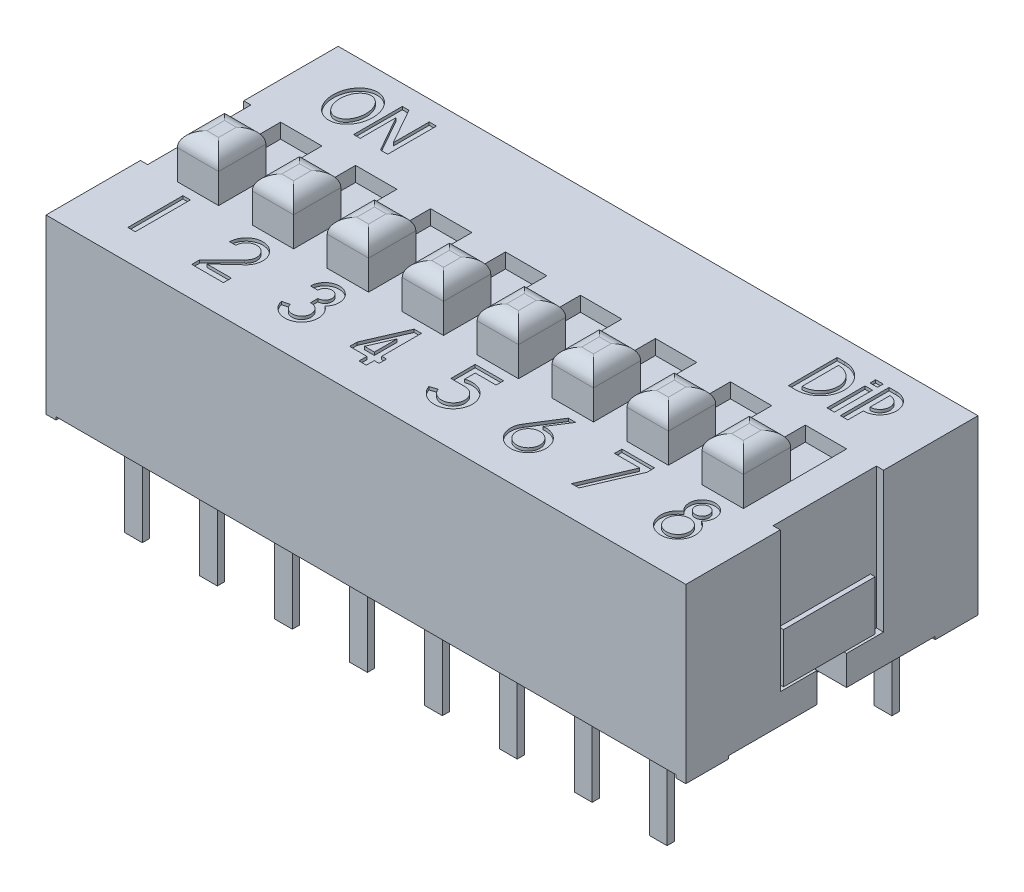
from build123d import *

# Parameters (mm, degrees)
SKETCH3_W                = 21.68
SKETCH3_H                = 9.9
BOSS_EXTRUDE2_DEPTH      = 5.85
SKETCH4_W                = 21
SKETCH4_H                = 0.2
CUT_EXTRUDE2_DEPTH       = 10
SKETCH5_W                = 7
SKETCH5_H                = 0.2
CUT_EXTRUDE3_DEPTH       = 22
SKETCH6_W                = 0.487470922
SKETCH6_H                = 3.5
CUT_EXTRUDE4_DEPTH       = 4.75
SKETCH7_W                = 0.995754675
SKETCH7_H                = 1
CUT_EXTRUDE5_DEPTH       = 22
BOSS_EXTRUDE3_DEPTH      = 0.15
BOSS_EXTRUDE3_DEPTH_BACK = 21.35
SKETCH8_W                = 3.1
SKETCH8_H                = 1.680627006
SKETCH9_W                = 1.4
SKETCH9_H                = 3.5
SKETCH9_W_2              = 1.401236364
CUT_EXTRUDE6_DEPTH       = 0.5
SKETCH12_W               = 1.4
SKETCH12_H               = 1.6
SKETCH12_W_2             = 1.401236364
BOSS_EXTRUDE4_DEPTH      = 2
FILLET1_R                = 0.5
SKETCH13_W               = 0.6
SKETCH13_H               = 0.25
SKETCH13_H_2             = 0.245714359
SKETCH13_H_3             = 0.242430455
SKETCH13_H_4             = 0.234982099
BOSS_EXTRUDE5_DEPTH      = 3.25
SKETCH14_RX              = 0.825749897
SKETCH14_RY              = 0.672122009
SKETCH14_RX_2            = 0.614511551
SKETCH14_RY_2            = 0.441680177
CUT_EXTRUDE7_DEPTH       = 0.1
CUT_EXTRUDE8_DEPTH       = 0.1
SKETCH16_W               = 0.253303666
SKETCH16_H               = 1.29006837
SKETCH16_H_2             = 0.191684563
CUT_EXTRUDE11_DEPTH      = 0.1
SKETCH17_R               = 0.396651096
SKETCH17_R_2             = 0.236606637
SKETCH17_R_3             = 0.394040753
SKETCH17_W               = 0.251849048
SKETCH17_H               = 1.867622834
CUT_EXTRUDE12_DEPTH      = 0.1


with BuildPart() as part:
    # Sketch3 → Boss-Extrude2 (new body)
    with BuildSketch(Plane(origin=(0, 0, 0), x_dir=(1, 0, 0), z_dir=(0, 1, 0))):
        Rectangle(SKETCH3_W, SKETCH3_H)
    extrude(amount=-BOSS_EXTRUDE2_DEPTH)

    # Sketch4 → Cut-Extrude2 (cut)
    with BuildSketch(Plane.XY.offset(4.95)):
        with Locations((0, -5.85)):
            Rectangle(SKETCH4_W, SKETCH4_H)
    extrude(amount=-CUT_EXTRUDE2_DEPTH, mode=Mode.SUBTRACT)

    # Sketch5 → Cut-Extrude3 (cut)
    with BuildSketch(Plane.ZY.offset(10.84)):
        with Locations((0, -5.85)):
            Rectangle(SKETCH5_W, SKETCH5_H)
    extrude(amount=-CUT_EXTRUDE3_DEPTH, mode=Mode.SUBTRACT)

    # Sketch6 → Cut-Extrude4 (cut)
    with BuildSketch(Plane(origin=(0, 0, 0), x_dir=(1, 0, 0), z_dir=(0, 1, 0))):
        with Locations((-10.84, 0)):
            Rectangle(SKETCH6_W, SKETCH6_H)
        with Locations((10.84, 0)):
            Rectangle(SKETCH6_W, SKETCH6_H)
    extrude(amount=-CUT_EXTRUDE4_DEPTH, mode=Mode.SUBTRACT)

    # Sketch7 → Cut-Extrude5 (cut)
    with BuildSketch(Plane.ZY.offset(10.84)):
        with Locations((0.001537773, -5.25)):
            Rectangle(SKETCH7_W, SKETCH7_H)
    extrude(amount=-CUT_EXTRUDE5_DEPTH, mode=Mode.SUBTRACT)

    # Sketch8 → Boss-Extrude3 (add, two sides: drawn at the far end of the back side and taken through both)
    with BuildSketch(Plane.ZY.offset(10.596264539).offset(-BOSS_EXTRUDE3_DEPTH_BACK)):
        with Locations((0, -3.909686497)):
            Rectangle(SKETCH8_W, SKETCH8_H)
    extrude(amount=BOSS_EXTRUDE3_DEPTH + BOSS_EXTRUDE3_DEPTH_BACK)

    # Sketch9 → Cut-Extrude6 (cut)
    with BuildSketch(Plane(origin=(0, 0, 0), x_dir=(1, 0, 0), z_dir=(0, 1, 0))):
        with Locations((-8.89, 0)):
            Rectangle(SKETCH9_W, SKETCH9_H)
        with Locations((-6.35, 0)):
            Rectangle(SKETCH9_W_2, SKETCH9_H)
        with Locations((-3.81, 0)):
            Rectangle(SKETCH9_W_2, SKETCH9_H)
        with Locations((-1.27, 0)):
            Rectangle(SKETCH9_W_2, SKETCH9_H)
        with Locations((1.27, 0)):
            Rectangle(SKETCH9_W_2, SKETCH9_H)
        with Locations((3.81, 0)):
            Rectangle(SKETCH9_W_2, SKETCH9_H)
        with Locations((6.35, 0)):
            Rectangle(SKETCH9_W_2, SKETCH9_H)
        with Locations((8.89, 0)):
            Rectangle(SKETCH9_W, SKETCH9_H)
    extrude(amount=-CUT_EXTRUDE6_DEPTH, mode=Mode.SUBTRACT)

    # Sketch12 → Boss-Extrude4 (add)
    with BuildSketch(Plane(origin=(0, -0.5, 0), x_dir=(1, 0, 0), z_dir=(0, 1, 0))):
        with Locations((-8.89, -0.95)):
            Rectangle(SKETCH12_W, SKETCH12_H)
        with Locations((-6.35, -0.95)):
            Rectangle(SKETCH12_W_2, SKETCH12_H)
        with Locations((-3.81, -0.95)):
            Rectangle(SKETCH12_W_2, SKETCH12_H)
        with Locations((-1.27, -0.95)):
            Rectangle(SKETCH12_W_2, SKETCH12_H)
        with Locations((1.27, -0.95)):
            Rectangle(SKETCH12_W_2, SKETCH12_H)
        with Locations((3.81, -0.95)):
            Rectangle(SKETCH12_W_2, SKETCH12_H)
        with Locations((6.35, -0.95)):
            Rectangle(SKETCH12_W_2, SKETCH12_H)
        with Locations((8.89, -0.95)):
            Rectangle(SKETCH12_W, SKETCH12_H)
    extrude(amount=BOSS_EXTRUDE4_DEPTH)

    # Fillet1
    fillet1_edges = [part.edges().sort_by_distance(p)[0] for p in [
        (-8.19, 1.5, 0.95),
        (-8.89, 1.5, 0.15),
        (-9.59, 1.5, 0.95),
        (-8.89, 1.5, 1.75),
        (-5.649381818, 1.5, 0.95),
        (-6.35, 1.5, 0.15),
        (-7.050618182, 1.5, 0.95),
        (-6.35, 1.5, 1.75),
        (-3.109381818, 1.5, 0.95),
        (-3.81, 1.5, 0.15),
        (-4.510618182, 1.5, 0.95),
        (-3.81, 1.5, 1.75),
        (-1.970618182, 1.5, 0.95),
        (-1.27, 1.5, 1.75),
        (-0.569381818, 1.5, 0.95),
        (-1.27, 1.5, 0.15),
        (1.970618182, 1.5, 0.95),
        (1.27, 1.5, 0.15),
        (0.569381818, 1.5, 0.95),
        (1.27, 1.5, 1.75),
        (4.510618182, 1.5, 0.95),
        (3.81, 1.5, 0.15),
        (3.109381818, 1.5, 0.95),
        (3.81, 1.5, 1.75),
        (7.050618182, 1.5, 0.95),
        (6.35, 1.5, 0.15),
        (5.649381818, 1.5, 0.95),
        (6.35, 1.5, 1.75),
        (9.59, 1.5, 0.95),
        (8.89, 1.5, 0.15),
        (8.19, 1.5, 0.95),
        (8.89, 1.5, 1.75),
    ]]
    fillet(fillet1_edges, radius=FILLET1_R)

    # Sketch13 → Boss-Extrude5 (add)
    with BuildSketch(Plane.XZ.offset(5.75)):
        with Locations((-8.89, 3.811537772)):
            Rectangle(SKETCH13_W, SKETCH13_H)
        with Locations((-6.35, 3.811537773)):
            Rectangle(SKETCH13_W, SKETCH13_H_2)
        with Locations((-3.81, 3.811537773)):
            Rectangle(SKETCH13_W, SKETCH13_H_3)
        with Locations((-1.27, 3.811537773)):
            Rectangle(SKETCH13_W, SKETCH13_H_4)
        with Locations((-1.27, -3.808462228)):
            Rectangle(SKETCH13_W, SKETCH13_H_4)
        with Locations((-3.81, -3.808462228)):
            Rectangle(SKETCH13_W, SKETCH13_H_3)
        with Locations((-6.35, -3.808462228)):
            Rectangle(SKETCH13_W, SKETCH13_H_2)
        with Locations((-8.89, -3.808462228)):
            Rectangle(SKETCH13_W, SKETCH13_H)
        with Locations((8.89, -3.808462228)):
            Rectangle(SKETCH13_W, SKETCH13_H)
        with Locations((6.35, -3.808462228)):
            Rectangle(SKETCH13_W, SKETCH13_H_2)
        with Locations((3.81, -3.808462228)):
            Rectangle(SKETCH13_W, SKETCH13_H_3)
        with Locations((1.27, -3.808462228)):
            Rectangle(SKETCH13_W, SKETCH13_H_4)
        with Locations((1.27, 3.811537773)):
            Rectangle(SKETCH13_W, SKETCH13_H_4)
        with Locations((3.81, 3.811537773)):
            Rectangle(SKETCH13_W, SKETCH13_H_3)
        with Locations((6.35, 3.811537773)):
            Rectangle(SKETCH13_W, SKETCH13_H_2)
        with Locations((8.89, 3.811537772)):
            Rectangle(SKETCH13_W, SKETCH13_H)
    extrude(amount=BOSS_EXTRUDE5_DEPTH)

    # Sketch14 → Cut-Extrude7 (cut)
    with BuildSketch(Plane(origin=(0, 0, 0), x_dir=(1, 0, 0), z_dir=(0, 1, 0))):
        with Locations(Location((-8.833603549, 3.447025733), (0, 0, -90))):
            Ellipse(SKETCH14_RX, SKETCH14_RY)
        with Locations(Location((-8.833603549, 3.447025733), (0, 0, -90))):
            Ellipse(SKETCH14_RX_2, SKETCH14_RY_2, mode=Mode.SUBTRACT)
    extrude(amount=-CUT_EXTRUDE7_DEPTH, mode=Mode.SUBTRACT)

    # Sketch15 → Cut-Extrude8 (cut)
    with BuildSketch(Plane(origin=(0, 0, 0), x_dir=(1, 0, 0), z_dir=(0, 1, 0))):
        Polygon((-7.078223666, 3.055881045), (-7.765171945, 4.272775629), (-7.989481588, 4.272775629), (-7.989481588, 4.235523754), (-7.989481588, 2.621275836), (-7.765171945, 2.621275836), (-7.765171945, 3.838170421), (-7.078223666, 2.621275836), (-6.832884995, 2.621275836), (-6.832884995, 4.272775629), (-7.078223666, 4.272775629), align=None)
    extrude(amount=-CUT_EXTRUDE8_DEPTH, mode=Mode.SUBTRACT)

    # Sketch16 → Cut-Extrude11 (cut)
    # profile 1 of 4: a face of its own
    with BuildSketch(Plane(origin=(0, 0, 0), x_dir=(1, 0, 0), z_dir=(0, 1, 0))):
        with BuildLine():
            Line((8.503859136, 4.272775629), (8.503859136, 2.621275836))
            Line((8.503859136, 2.621275836), (8.758379197, 2.621275836))
            Line((8.758379197, 2.621275836), (8.758379197, 3.146668115))
            ThreePointArc((8.758379197, 3.146668115), (9.321545029, 3.721183128), (8.735909505, 4.272775629))
            Line((8.735909505, 4.272775629), (8.503859136, 4.272775629))
        make_face()
        with BuildLine():
            Line((8.758379197, 3.373503286), (8.758379197, 4.046388806))
            ThreePointArc((8.758379197, 4.046388806), (9.094821956, 3.709946046), (8.758379197, 3.373503286))
        make_face(mode=Mode.SUBTRACT)
    # profile 2 of 4: a face of its own
    with BuildSketch(Plane(origin=(0, 0, 0), x_dir=(1, 0, 0), z_dir=(0, 1, 0))):
        with Locations((8.176814656, 3.266310021)):
            Rectangle(SKETCH16_W, SKETCH16_H)
    # profile 3 of 4: a face of its own
    with BuildSketch(Plane(origin=(0, 0, 0), x_dir=(1, 0, 0), z_dir=(0, 1, 0))):
        with Locations((8.176814656, 4.176933348)):
            Rectangle(SKETCH16_W, SKETCH16_H_2)
    # profile 4 of 4: a face of its own
    with BuildSketch(Plane(origin=(0, 0, 0), x_dir=(1, 0, 0), z_dir=(0, 1, 0))):
        with BuildLine():
            Line((6.744772794, 2.621275836), (6.99870361, 2.621275836))
            ThreePointArc((6.99870361, 2.621275836), (7.824453507, 3.447025733), (6.99870361, 4.272775629))
            Line((6.99870361, 4.272775629), (6.744772794, 4.272775629))
            Line((6.744772794, 4.272775629), (6.744772794, 2.621275836))
        make_face()
        with BuildLine():
            ThreePointArc((6.99870361, 4.063589234), (7.615267112, 3.447025733), (6.99870361, 2.830462231))
            Line((6.99870361, 2.830462231), (6.99870361, 4.063589234))
        make_face(mode=Mode.SUBTRACT)
    extrude(amount=-CUT_EXTRUDE11_DEPTH, mode=Mode.SUBTRACT)

    # Sketch17 → Cut-Extrude12 (cut)
    # profile 1 of 8: a face of its own
    with BuildSketch(Plane(origin=(0, 0, 0), x_dir=(1, 0, 0), z_dir=(0, 1, 0))):
        with BuildLine():
            Line((-6.92020644, -3.92998461), (-5.848887197, -3.92998461))
            Line((-5.848887197, -3.92998461), (-5.848887197, -3.662069146))
            Line((-5.848887197, -3.662069146), (-6.678585358, -3.662069146))
            Line((-6.678585358, -3.662069146), (-6.00025722, -3.035275315))
            ThreePointArc((-6.00025722, -3.035275315), (-6.156094794, -2.109396738), (-6.941871566, -2.623294931))
            Line((-6.941871566, -2.623294931), (-6.736142548, -2.623294931))
            ThreePointArc((-6.736142548, -2.623294931), (-6.265997626, -2.287201796), (-6.100121828, -2.840808211))
            ThreePointArc((-6.100121828, -2.840808211), (-6.129771155, -2.874462186), (-6.163425131, -2.904111514))
            Line((-6.163425131, -2.904111514), (-6.92020644, -3.660892823))
            Line((-6.92020644, -3.660892823), (-6.92020644, -3.92998461))
        make_face()
    # profile 2 of 8: a face of its own
    with BuildSketch(Plane(origin=(0, 0, 0), x_dir=(1, 0, 0), z_dir=(0, 1, 0))):
        with BuildLine():
            ThreePointArc((-3.785169077, -2.79429728), (-3.616951009, -2.379713319), (-4.029890813, -2.551928005))
            Line((-4.029890813, -2.551928005), (-4.27707646, -2.551928005))
            ThreePointArc((-4.27707646, -2.551928005), (-3.600862661, -2.099337929), (-3.440263113, -2.897028762))
            ThreePointArc((-3.440263113, -2.897028762), (-3.447840424, -3.832214558), (-4.319201534, -3.492568119))
            Line((-4.319201534, -3.492568119), (-4.078634995, -3.435748365))
            ThreePointArc((-4.078634995, -3.435748365), (-3.50988895, -3.554596248), (-3.782779914, -3.041636791))
            Line((-3.782779914, -3.041636791), (-3.785169077, -2.79429728))
        make_face()
    # profile 3 of 8: a face of its own
    with BuildSketch(Plane(origin=(0, 0, 0), x_dir=(1, 0, 0), z_dir=(0, 1, 0))):
        Polygon((-0.843938236, -3.407911848), (-0.843938236, -3.662069146), (-1.005546989, -3.662069146), (-1.005546989, -3.92998461), (-1.254693817, -3.92998461), (-1.254693817, -3.662069146), (-1.840385561, -3.662069146), (-1.840385561, -3.407911848), (-1.254693817, -2.062361776), (-1.005546989, -2.062361776), (-1.005546989, -3.407911848), align=None)
        Polygon((-1.254693817, -2.634523596), (-1.254693817, -3.407911848), (-1.591334663, -3.407911848), align=None, mode=Mode.SUBTRACT)
    # profile 4 of 8: a face of its own
    with BuildSketch(Plane(origin=(0, 0, 0), x_dir=(1, 0, 0), z_dir=(0, 1, 0))):
        with BuildLine():
            Line((1.070297366, -2.676966423), (1.070297366, -2.315223826))
            Line((1.070297366, -2.315223826), (1.778120854, -2.315223826))
            Line((1.778120854, -2.315223826), (1.778120854, -2.062361776))
            Line((1.778120854, -2.062361776), (0.815431893, -2.062361776))
            Line((0.815431893, -2.062361776), (0.815431893, -2.315223826))
            Line((0.815431893, -2.315223826), (0.815431893, -2.871362794))
            Line((0.815431893, -2.871362794), (0.815431893, -2.887253829))
            Line((0.815431893, -2.887253829), (1.290885287, -2.887253829))
            ThreePointArc((1.290885287, -2.887253829), (1.614872518, -3.513157997), (0.916770914, -3.41631842))
            Line((0.916770914, -3.41631842), (0.681895582, -3.499353255))
            ThreePointArc((0.681895582, -3.499353255), (1.874948455, -3.559903642), (1.070297366, -2.676966423))
        make_face()
    # profile 5 of 8: a face of its own
    with BuildSketch(Plane(origin=(0, 0, 0), x_dir=(1, 0, 0), z_dir=(0, 1, 0))):
        with BuildLine():
            Line((3.970391597, -2.062361776), (3.373869118, -3.008923454))
            ThreePointArc((3.373869118, -3.008923454), (4.212937591, -3.830696126), (3.787687625, -2.735931908))
            Line((3.787687625, -2.735931908), (4.222883941, -2.062361776))
            Line((4.222883941, -2.062361776), (3.970391597, -2.062361776))
        make_face()
        with Locations(Location((3.882121903, -3.329223988, 0), (0, 0, 270))):
            Circle(SKETCH17_R, mode=Mode.SUBTRACT)
    # profile 6 of 8: a face of its own
    with BuildSketch(Plane(origin=(0, 0, 0), x_dir=(1, 0, 0), z_dir=(0, 1, 0))):
        Polygon((5.787533594, -2.315223826), (6.641247022, -2.315223826), (5.946375272, -3.92998461), (6.197467457, -3.92998461), (6.892339207, -2.315223826), (6.892339207, -2.062361776), (5.787533594, -2.062361776), align=None)
    # profile 7 of 8: a face of its own
    with BuildSketch(Plane(origin=(0, 0, 0), x_dir=(1, 0, 0), z_dir=(0, 1, 0))):
        with BuildLine():
            ThreePointArc((8.657620274, -2.837470358), (8.975576567, -3.929879543), (9.252060211, -2.826244265))
            ThreePointArc((9.252060211, -2.826244265), (8.940309685, -2.062440609), (8.657620274, -2.837470358))
        make_face()
        with Locations(Location((8.948659103, -2.504555896, 0), (0, 0, 270))):
            Circle(SKETCH17_R_2, mode=Mode.SUBTRACT)
        with Locations(Location((8.964448717, -3.340641687, 0), (0, 0, 270))):
            Circle(SKETCH17_R_3, mode=Mode.SUBTRACT)
    # profile 8 of 8: a face of its own
    with BuildSketch(Plane(origin=(0, 0, 0), x_dir=(1, 0, 0), z_dir=(0, 1, 0))):
        with Locations((-8.961856992, -2.996173193)):
            Rectangle(SKETCH17_W, SKETCH17_H)
    extrude(amount=-CUT_EXTRUDE12_DEPTH, mode=Mode.SUBTRACT)


solid = part.part
